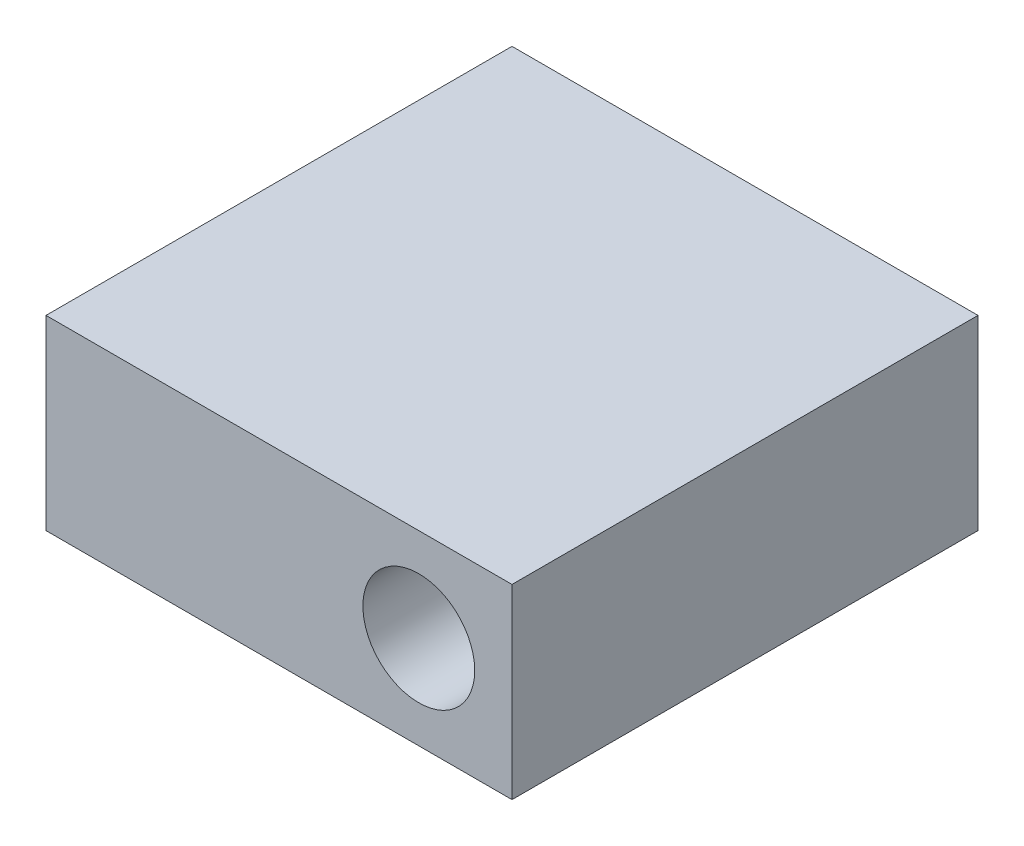
from build123d import *

# Parameters (mm, degrees)
SKETCH1_W           = 25
SKETCH1_H           = 25
BOSS_EXTRUDE1_DEPTH = 10
SKETCH2_R           = 3
CUT_EXTRUDE1_DEPTH  = 10


with BuildPart() as part:
    # Sketch1 → Boss-Extrude1 (new body)
    with BuildSketch(Plane(origin=(0, 0, 0), x_dir=(1, 0, 0), z_dir=(0, 1, 0))):
        Rectangle(SKETCH1_W, SKETCH1_H)
    extrude(amount=BOSS_EXTRUDE1_DEPTH)

    # Sketch2 → Cut-Extrude1 (cut)
    with BuildSketch(Plane.XY.offset(12.5)):
        with Locations((7.5, 5)):
            Circle(SKETCH2_R)
    extrude(amount=-CUT_EXTRUDE1_DEPTH, mode=Mode.SUBTRACT)


solid = part.part
